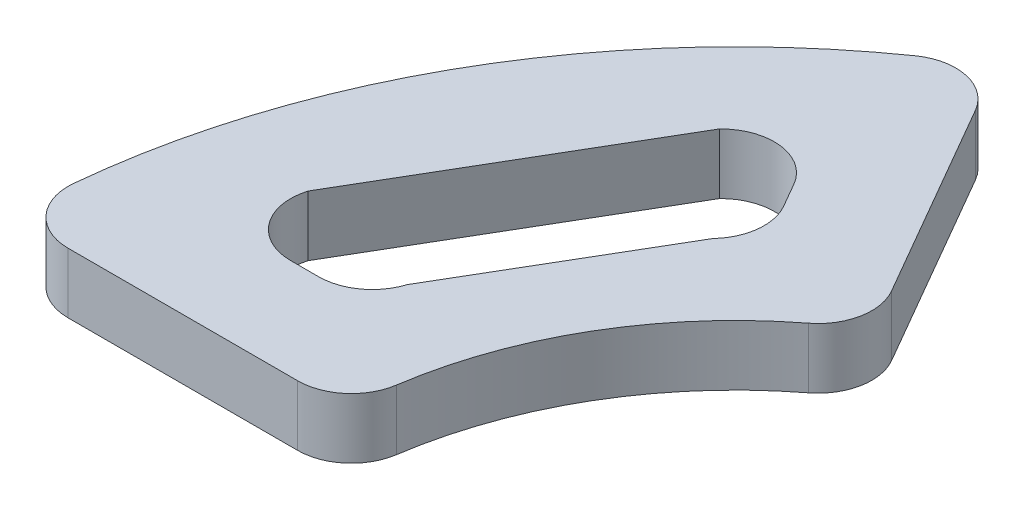
from build123d import *

# Parameters (mm, degrees)
BOSS_EXTRUDE1_DEPTH = 4.5


with BuildPart() as part:
    # Sketch1 → Boss-Extrude1 (new, symmetric)
    with BuildSketch(Plane(origin=(0, 0, 0), x_dir=(1, 0, 0), z_dir=(0, 1, 0))):
        with BuildLine():
            Line((-101.508620324, 2), (-67.260686883, 2))
            ThreePointArc((-67.260686883, 2), (-62.036309634, 3.941462028), (-59.347664897, 8.823529412))
            ThreePointArc((-59.347664897, 8.823529412), (-51.737318493, 30.385027154), (-36.613340144, 47.533812423))
            ThreePointArc((-36.613340144, 47.533812423), (-33.647401917, 52.31816148), (-34.5669156, 57.87165408))
            Line((-34.5669156, 57.87165408), (-51.667108069, 87.490056256))
            ThreePointArc((-51.667108069, 87.490056256), (-56.868026794, 91.301361412), (-63.19102199, 90.038295963))
            ThreePointArc((-63.19102199, 90.038295963), (-94.99085495, 55.468346611), (-109.470080741, 10.784313725))
            ThreePointArc((-109.470080741, 10.784313725), (-107.436288913, 4.627594105), (-101.508620324, 2))
        make_face()
        with BuildLine():
            Line((-53.583601177, 60.80951969), (-55.668486055, 64.420646227))
            ThreePointArc((-55.668486055, 64.420646227), (-61.622662682, 68.361129347), (-68.352706691, 65.97656772))
            Line((-68.352706691, 65.97656772), (-90.993256658, 27.298850575))
            ThreePointArc((-90.993256658, 27.298850575), (-89.749031081, 20.224584028), (-83.330666624, 17))
            Line((-83.330666624, 17), (-79.14543575, 17))
            ThreePointArc((-79.14543575, 17), (-74.41664671, 18.547205705), (-71.516960015, 22.590361446))
            Line((-71.516960015, 22.590361446), (-54.679341331, 51.333903335))
            ThreePointArc((-54.679341331, 51.333903335), (-52.564762349, 55.890540621), (-53.583601177, 60.80951969))
        make_face(mode=Mode.SUBTRACT)
    extrude(amount=BOSS_EXTRUDE1_DEPTH, both=True)


solid = part.part
